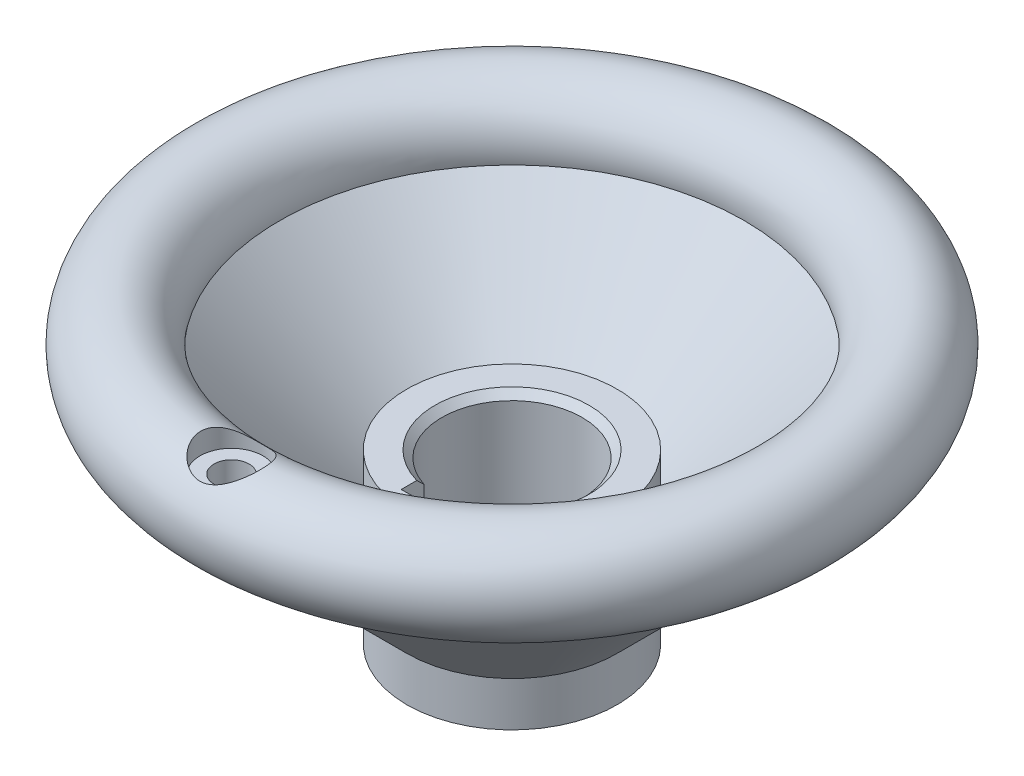
from build123d import *

# Parameters (mm, degrees)
SKETCH_1_R             = 7.5
EXTRUDE_1_DEPTH        = 12
CUT_EXTRUDE_1_DEPTH    = 36.334119621
CHAMFER_1_SIZE         = 0.5
HOLE_WIZARD_1_D        = 4.5
HOLE_WIZARD_1_DEPTH    = 1.5
HOLE_WIZARD_M3_1_D     = 2.5
HOLE_WIZARD_M3_1_DEPTH = 3.248924226
HOLE_WIZARD_M3_1_TIP   = 0.751075774


with BuildPart() as part:
    # 草图1 → 凸台-拉伸1 (new body)
    with BuildSketch(Plane(origin=(0, 0, 0), x_dir=(1, 0, 0), z_dir=(0, 1, 0))):
        with Locations(Location((0, 0, 0), (0, 0, 270))):
            Circle(SKETCH_1_R)
    extrude(amount=EXTRUDE_1_DEPTH)

    # 草图2 → 旋转1 (revolve)
    with BuildSketch(Plane.XY, mode=Mode.PRIVATE) as revolve_1_sk:
        with BuildLine():
            Line((2.982229812, 4.310656936), (5.810656936, 1.482229812))
            Line((5.810656936, 1.482229812), (19.383203961, 15.054776836))
            ThreePointArc((19.383203961, 15.054776836), (22.474873734, 20.974873734), (16.554776836, 17.883203961))
            Line((16.554776836, 17.883203961), (2.982229812, 4.310656936))
        make_face()
    revolve(revolve_1_sk.sketch.rotate(Axis((0, 0, 0), (0, 1, 0)), 270), axis=Axis((0, 0, 0), (0, 1, 0)))

    # 草图3 → 切除-拉伸1 (cut, through all)
    with BuildSketch(Plane(origin=(0, 12, 0), x_dir=(1, 0, 0), z_dir=(0, 1, 0))):
        with BuildLine():
            Line((-1.5, -4.769696007), (-1.5, -6.4))
            Line((-1.5, -6.4), (1.5, -6.4))
            Line((1.5, -6.4), (1.5, -4.769696007))
            ThreePointArc((1.5, -4.769696007), (0, 5), (-1.5, -4.769696007))
        make_face()
    extrude(amount=-CUT_EXTRUDE_1_DEPTH, mode=Mode.SUBTRACT)

    # 倒角1
    chamfer_1_edges = [part.edges().sort_by_distance(p)[0] for p in [
        (0, 0, -5),
        (0, 12, -5),
    ]]
    chamfer(chamfer_1_edges, length=CHAMFER_1_SIZE)

    # 孔1
    with Locations(Plane(origin=(0, 22, 20), x_dir=(0, 0, 1), z_dir=(0, 1, 0))):
        with Locations((0, 0)):
            Hole(HOLE_WIZARD_1_D / 2, depth=HOLE_WIZARD_1_DEPTH)

    # M3 螺纹孔1
    with Locations(Plane(origin=(0, 20.5, 0), x_dir=(1, 0, 0), z_dir=(0, 1, 0))):
        with Locations((0, -20), (0, 0)):
            Hole(HOLE_WIZARD_M3_1_D / 2, depth=HOLE_WIZARD_M3_1_DEPTH)
            with Locations((0, 0, -(HOLE_WIZARD_M3_1_DEPTH + HOLE_WIZARD_M3_1_TIP / 2))):  # 118° drill point
                Cone(0, HOLE_WIZARD_M3_1_D / 2, HOLE_WIZARD_M3_1_TIP, mode=Mode.SUBTRACT)


solid = part.part
